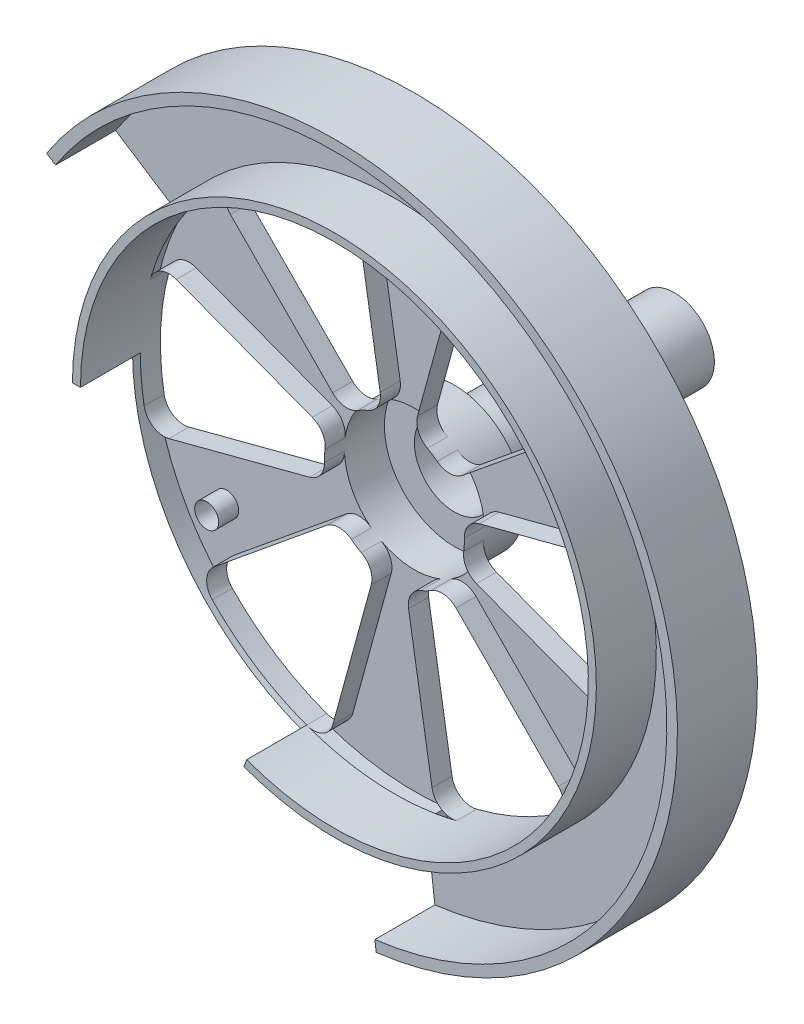
from build123d import *
from build123d.topology import SkipClean

# Parameters (mm, degrees)
SCHIZZO2_R                   = 65.5
ESTRUSIONE_ESTRUSIONE1_DEPTH = 5
TAGLIO_ESTRUSIONE1_DEPTH     = 5
ESTRUSIONE_ESTRUSIONE2_START = 15
ESTRUSIONE_ESTRUSIONE2_DEPTH = 15
ESTRUSIONE_ESTRUSIONE3_DEPTH = 5
ESTRUSIONE_ESTRUSIONE4_DEPTH = 15
SCHIZZO7_R                   = 17.5
ESTRUSIONE_ESTRUSIONE5_DEPTH = 10
SCHIZZO8_R                   = 10
ESTRUSIONE_ESTRUSIONE6_DEPTH = 55
SCHIZZO9_R                   = 3
TAGLIO_ESTRUSIONE2_DEPTH     = 141.058619156


with BuildPart() as part:
    # Schizzo2 → Estrusione-Estrusione1 (new body)
    with BuildSketch(Plane.XY):
        Circle(SCHIZZO2_R)
    extrude(amount=ESTRUSIONE_ESTRUSIONE1_DEPTH)

    # Schizzo3 → Taglio-Estrusione1 (cut)
    with BuildSketch(Plane.XY.offset(5)):
        with BuildLine():
            ThreePointArc((-15.580303655, 61.558948481), (-11.6121535, 60.893291099), (-9.419229509, 57.519806288))
            Line((-9.419229509, 57.519806288), (-3.545169438, 21.649059417))
            ThreePointArc((-3.545169438, 21.649059417), (-4.118256573, 18.395634586), (-6.595126238, 16.20969802))
            ThreePointArc((-6.595126238, 16.20969802), (-7.944833745, 15.592614173), (-9.237403233, 14.863390647))
            ThreePointArc((-9.237403233, 14.863390647), (-12.461730523, 14.144422271), (-15.430658669, 15.593100175))
            Line((-15.430658669, 15.593100175), (-40.998016607, 41.429610598))
            ThreePointArc((-40.998016607, 41.429610598), (-42.438254768, 45.186607995), (-40.644362762, 48.788172498))
            ThreePointArc((-40.644362762, 48.788172498), (-28.828396733, 56.578914286), (-15.580303655, 61.558948481))
        make_face()
        with BuildLine():
            ThreePointArc((10.740447155, 13.816395873), (9.531183113, 14.676734939), (8.25337227, 15.431521188))
            ThreePointArc((8.25337227, 15.431521188), (6.018563747, 17.864386344), (5.788691541, 21.159892491))
            Line((5.788691541, 21.159892491), (15.380086943, 56.220129185))
            ThreePointArc((15.380086943, 56.220129185), (17.91362305, 59.345910719), (21.929615406, 59.593136921))
            ThreePointArc((21.929615406, 59.593136921), (34.584578723, 53.255581065), (45.521461387, 44.272413004))
            ThreePointArc((45.521461387, 44.272413004), (46.929060262, 40.503065473), (45.103998712, 36.917195183))
            Line((45.103998712, 36.917195183), (16.976050705, 13.894736502))
            ThreePointArc((16.976050705, 13.894736502), (13.871958583, 12.764332104), (10.740447155, 13.816395873))
        make_face()
        with BuildLine():
            ThreePointArc((17.335573392, -2.393302147), (17.476016858, -0.915879234), (17.490775503, 0.568130541))
            ThreePointArc((17.490775503, 0.568130541), (18.48029427, 3.719964073), (21.219350209, 5.566792317))
            Line((21.219350209, 5.566792317), (56.37810355, 14.790518587))
            ThreePointArc((56.37810355, 14.790518587), (60.351877818, 14.159302724), (62.573978168, 10.804964424))
            ThreePointArc((62.573978168, 10.804964424), (63.412975457, -3.323333221), (61.101765042, -17.286535477))
            ThreePointArc((61.101765042, -17.286535477), (58.541213762, -20.390225626), (54.523228221, -20.602611105))
            Line((54.523228221, -20.602611105), (20.521220142, -7.754322915))
            ThreePointArc((20.521220142, -7.754322915), (17.990215156, -5.631302481), (17.335573392, -2.393302147))
        make_face()
        with BuildLine():
            ThreePointArc((6.595126238, -16.20969802), (7.944833745, -15.592614173), (9.237403233, -14.863390647))
            ThreePointArc((9.237403233, -14.863390647), (12.461730523, -14.144422271), (15.430658669, -15.593100175))
            Line((15.430658669, -15.593100175), (40.998016607, -41.429610598))
            ThreePointArc((40.998016607, -41.429610598), (42.438254768, -45.186607995), (40.644362762, -48.788172498))
            ThreePointArc((40.644362762, -48.788172498), (28.828396733, -56.578914286), (15.580303655, -61.558948481))
            ThreePointArc((15.580303655, -61.558948481), (11.6121535, -60.893291099), (9.419229509, -57.519806288))
            Line((9.419229509, -57.519806288), (3.545169438, -21.649059417))
            ThreePointArc((3.545169438, -21.649059417), (4.118256573, -18.395634586), (6.595126238, -16.20969802))
        make_face()
        with BuildLine():
            ThreePointArc((-10.740447155, -13.816395873), (-9.531183113, -14.676734939), (-8.25337227, -15.431521188))
            ThreePointArc((-8.25337227, -15.431521188), (-6.018563747, -17.864386344), (-5.788691541, -21.159892491))
            Line((-5.788691541, -21.159892491), (-15.380086943, -56.220129185))
            ThreePointArc((-15.380086943, -56.220129185), (-17.91362305, -59.345910719), (-21.929615406, -59.593136921))
            ThreePointArc((-21.929615406, -59.593136921), (-34.584578723, -53.255581065), (-45.521461387, -44.272413004))
            ThreePointArc((-45.521461387, -44.272413004), (-46.929060262, -40.503065473), (-45.103998712, -36.917195183))
            Line((-45.103998712, -36.917195183), (-16.976050705, -13.894736502))
            ThreePointArc((-16.976050705, -13.894736502), (-13.871958583, -12.764332104), (-10.740447155, -13.816395873))
        make_face()
        with BuildLine():
            ThreePointArc((-17.335573392, 2.393302147), (-17.476016858, 0.915879234), (-17.490775503, -0.568130541))
            ThreePointArc((-17.490775503, -0.568130541), (-18.48029427, -3.719964073), (-21.219350209, -5.566792317))
            Line((-21.219350209, -5.566792317), (-56.37810355, -14.790518587))
            ThreePointArc((-56.37810355, -14.790518587), (-60.351877818, -14.159302724), (-62.573978168, -10.804964424))
            ThreePointArc((-62.573978168, -10.804964424), (-63.412975457, 3.323333221), (-61.101765042, 17.286535477))
            ThreePointArc((-61.101765042, 17.286535477), (-58.541213762, 20.390225626), (-54.523228221, 20.602611105))
            Line((-54.523228221, 20.602611105), (-20.521220142, 7.754322915))
            ThreePointArc((-20.521220142, 7.754322915), (-17.990215156, 5.631302481), (-17.335573392, 2.393302147))
        make_face()
    extrude(amount=-TAGLIO_ESTRUSIONE1_DEPTH, mode=Mode.SUBTRACT)

    # Schizzo4 → Estrusione-Estrusione2 (add)
    with SkipClean():  # the faces are left unmerged after this step: merging them gives an invalid solid
        with BuildSketch(Plane.XY.offset(5).offset(ESTRUSIONE_ESTRUSIONE2_START)):
            with BuildLine():
                Line((-65.499588659, 0.23213256), (-63.499601219, 0.225044543))
                ThreePointArc((-63.499601219, 0.225044543), (52.144908397, 36.23752928), (-21.929615406, -59.593136921))
                Line((-21.929615406, -59.593136921), (-22.620311954, -61.470086116))
                ThreePointArc((-22.620311954, -61.470086116), (53.787267716, 37.378868785), (-65.499588659, 0.23213256))
            make_face()
        extrude(amount=-ESTRUSIONE_ESTRUSIONE2_DEPTH)

    # Schizzo5 → Estrusione-Estrusione3 (add)
    with SkipClean():  # the faces are left unmerged after this step: merging them gives an invalid solid
        with BuildSketch(Plane.XY):
            with BuildLine():
                Line((-71.941161318, 46.719136424), (-54.9329222, 35.673856793))
                ThreePointArc((-54.9329222, 35.673856793), (55.547150298, 34.709711807), (7.982441993, -65.011772933))
                Line((7.982441993, -65.011772933), (10.453952277, -85.140608888))
                ThreePointArc((10.453952277, -85.140608888), (72.745565688, 45.456474486), (-71.941161318, 46.719136424))
            make_face()
        extrude(amount=ESTRUSIONE_ESTRUSIONE3_DEPTH)

    # Schizzo6 → Estrusione-Estrusione4 (add)
    with SkipClean():  # the faces are left unmerged after this step: merging them gives an invalid solid
        with BuildSketch(Plane.XY.offset(5)):
            with BuildLine():
                Line((-71.941161318, 46.719136424), (-69.71449096, 45.273119786))
                ThreePointArc((-69.71449096, 45.273119786), (70.493997993, 44.049538839), (10.130389171, -82.505398855))
                Line((10.130389171, -82.505398855), (10.453952277, -85.140608888))
                ThreePointArc((10.453952277, -85.140608888), (72.745565688, 45.456474486), (-71.941161318, 46.719136424))
            make_face()
        extrude(amount=ESTRUSIONE_ESTRUSIONE4_DEPTH)

    # Schizzo7 → Estrusione-Estrusione5 (add)
    with SkipClean():  # the faces are left unmerged after this step: merging them gives an invalid solid
        with BuildSketch(Plane(origin=(0, 0, 0), x_dir=(-1, 0, 0), z_dir=(0, 0, -1))):
            with Locations(Location((0, 0, 0), (0, 0, 178.139588407))):
                Circle(SCHIZZO7_R)
        extrude(amount=ESTRUSIONE_ESTRUSIONE5_DEPTH)

    # Schizzo8 → Estrusione-Estrusione6 (add)
    with SkipClean():  # the faces are left unmerged after this step: merging them gives an invalid solid
        with BuildSketch(Plane(origin=(0, 0, -10), x_dir=(-1, 0, 0), z_dir=(0, 0, -1))):
            Circle(SCHIZZO8_R)
        extrude(amount=ESTRUSIONE_ESTRUSIONE6_DEPTH)

    # Schizzo9 → Taglio-Estrusione2 (cut, through all)
    with SkipClean():  # the faces are left unmerged after this step: merging them gives an invalid solid
        with BuildSketch(Plane.XY.offset(5)):
            with Locations((-46.929060262, -26.714477403)):
                Circle(SCHIZZO9_R)
        extrude(amount=-TAGLIO_ESTRUSIONE2_DEPTH, mode=Mode.SUBTRACT)


solid = part.part
